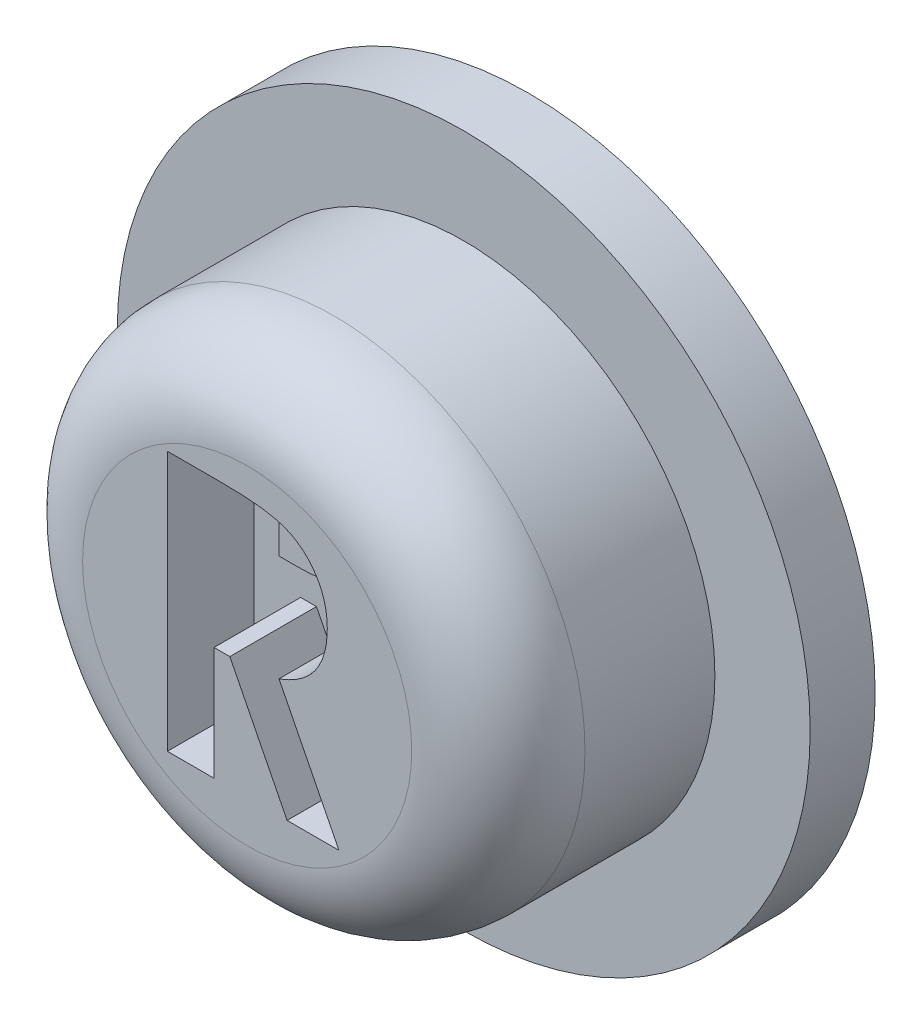
from build123d import *

# Parameters (mm, degrees)
SZKIC1_R                    = 4
DODANIE_WYCI_GNI_CIE1_DEPTH = 0.75
SZKIC2_R                    = 2.9
DODANIE_WYCI_GNI_CIE2_DEPTH = 2.5
SZKIC3_W                    = 2.5
SZKIC3_H                    = 2.5
WYTNIJ_WYCI_GNI_CIE1_DEPTH  = 1
ZAOKR_GLENIE2_R             = 1
SZKIC4_W                    = 2.9
SZKIC4_H                    = 2.9
WYTNIJ_WYCI_GNI_CIE2_DEPTH  = 1
WYTNIJ_WYCI_GNI_CIE3_DEPTH  = 1
WYTNIJ_WYCI_GNI_CIE4_DEPTH  = 0.75


with BuildPart() as part:
    # Szkic1 → Dodanie-wyciągnięcie1 (new body)
    with BuildSketch(Plane.XY):
        Circle(SZKIC1_R)
    extrude(amount=DODANIE_WYCI_GNI_CIE1_DEPTH)

    # Szkic2 → Dodanie-wyciągnięcie2 (add)
    with BuildSketch(Plane.XY.offset(0.75)):
        Circle(SZKIC2_R)
    extrude(amount=DODANIE_WYCI_GNI_CIE2_DEPTH)

    # Szkic3 → Wytnij-wyciągnięcie1 (cut)
    with BuildSketch(Plane(origin=(0, 0, 0), x_dir=(-1, 0, 0), z_dir=(0, 0, -1))):
        Rectangle(SZKIC3_W, SZKIC3_H)
    extrude(amount=-WYTNIJ_WYCI_GNI_CIE1_DEPTH, mode=Mode.SUBTRACT)

    # Zaokrąglenie2
    zaokr_glenie2_edges = [part.edges().sort_by_distance(p)[0] for p in [
        (-2.9, 0, 3.25),
    ]]
    fillet(zaokr_glenie2_edges, radius=ZAOKR_GLENIE2_R)

    # Szkic4 → Wytnij-wyciągnięcie2 (cut)
    with BuildSketch(Plane(origin=(0, 0, 0), x_dir=(-1, 0, 0), z_dir=(0, 0, -1))):
        Rectangle(SZKIC4_W, SZKIC4_H)
    extrude(amount=-WYTNIJ_WYCI_GNI_CIE2_DEPTH, mode=Mode.SUBTRACT)

    # Szkic5 → Wytnij-wyciągnięcie3 (cut)
    with BuildSketch(Plane.XY.offset(3.25)):
        with BuildLine():
            Line((-0.921182905, 1.584423241), (-0.293779059, 1.584423241))
            add(Edge.make_bspline(
                [(-0.293779059, 1.584423241), (-0.252307855, 1.584276042), (-0.17254705, 1.583992937), (-0.057536324, 1.579526289), (0.048116843, 1.573310581), (0.144568883, 1.563825246), (0.23177853, 1.551248838), (0.309833189, 1.536423335), (0.378730579, 1.519526495), (0.439051754, 1.4984717), (0.493488632, 1.47472221), (0.54423137, 1.44743361), (0.592399429, 1.416909768), (0.637670857, 1.382347519), (0.680439074, 1.344368629), (0.720784764, 1.302934869), (0.758137806, 1.257694897), (0.792266907, 1.208934573), (0.823372836, 1.15763983), (0.850863953, 1.10374024), (0.873219776, 1.04719832), (0.892973541, 0.988831223), (0.907201538, 0.927804579), (0.917096902, 0.864712494), (0.924341901, 0.799332876), (0.924758453, 0.754916866), (0.924970941, 0.73225978)],
                knots=[0, 0, 0, 0, 1.749336639, 3.364467119, 4.854658419, 6.213483162, 7.451590619, 8.570285859, 9.5643256, 10.440900261, 11.26203566, 12.067320669, 12.869050712, 13.665104639, 14.467235401, 15.27997916, 16.102287765, 16.939272006, 17.78853747, 18.631303466, 19.488103222, 20.351255419, 21.228522269, 22.127379805, 23.044756219, 24, 24, 24, 24], degree=3))
            add(Edge.make_bspline(
                [(0.924970941, 0.73225978), (0.924418974, 0.708610987), (0.923336666, 0.662240014), (0.917506767, 0.594124836), (0.906851544, 0.528956999), (0.890712658, 0.466927305), (0.872163104, 0.407263723), (0.847496956, 0.351067083), (0.819658771, 0.297520087), (0.786596171, 0.247380176), (0.750311583, 0.199533643), (0.70811337, 0.155813667), (0.662735328, 0.113870465), (0.611626594, 0.076331215), (0.557040086, 0.040657651), (0.497891228, 0.008327901), (0.434566047, -0.021470729), (0.390045308, -0.038088504), (0.367278634, -0.046586374)],
                knots=[0, 0, 0, 0, 1.099860209, 2.156625411, 3.176576793, 4.16617041, 5.135385252, 6.078461593, 7.016046972, 7.938469504, 8.868247731, 9.803980173, 10.76021508, 11.73834243, 12.748633912, 13.790971185, 14.870363756, 16, 16, 16, 16], degree=3))
            Line((0.367278634, -0.046586374), (1.059586326, -1.415576759))
            Line((1.059586326, -1.415576759), (0.461028634, -1.415576759))
            Line((0.461028634, -1.415576759), (-0.200029059, -0.107884451))
            Line((-0.200029059, -0.107884451), (-0.382721366, -0.107884451))
            Line((-0.382721366, -0.107884451), (-0.382721366, -1.415576759))
            Line((-0.382721366, -1.415576759), (-0.921182905, -1.415576759))
            Line((-0.921182905, -1.415576759), (-0.921182905, 1.584423241))
        make_face()
        with BuildLine():
            Line((-0.382721366, 0.430577087), (-0.172985789, 0.430577087))
            add(Edge.make_bspline(
                [(-0.172985789, 0.430577087), (-0.147343872, 0.430865884), (-0.098245109, 0.431418867), (-0.02763464, 0.433983833), (0.036496506, 0.440164132), (0.09442373, 0.44797271), (0.146438515, 0.456988841), (0.192076908, 0.469909503), (0.232042127, 0.48375432), (0.265860584, 0.500959836), (0.294754296, 0.520526239), (0.319702167, 0.54275416), (0.340337634, 0.568480148), (0.357321675, 0.597005082), (0.370533413, 0.628581257), (0.38017697, 0.66286204), (0.385566291, 0.700237931), (0.386186351, 0.726032386), (0.386509403, 0.739471318)],
                knots=[0, 0, 0, 0, 1.688639943, 3.233382647, 4.650958383, 5.928841754, 7.082724185, 8.122798841, 9.049171256, 9.863274652, 10.613301712, 11.341792392, 12.054588806, 12.776240173, 13.521029143, 14.301969904, 15.115324896, 16, 16, 16, 16], degree=3))
            add(Edge.make_bspline(
                [(0.386509403, 0.739471318), (0.385898644, 0.755370556), (0.384698922, 0.786601663), (0.372793947, 0.831563506), (0.353843798, 0.873178768), (0.327868335, 0.911259421), (0.295155616, 0.94464355), (0.257615189, 0.974071926), (0.214436843, 0.997341683), (0.174456944, 1.012690168), (0.138084581, 1.021873324), (0.10525967, 1.028716531), (0.067248226, 1.033566508), (0.024021552, 1.038710772), (-0.024310165, 1.042046567), (-0.078010364, 1.044481033), (-0.136924816, 1.045477092), (-0.177993785, 1.045795515), (-0.199428097, 1.045961703)],
                knots=[0, 0, 0, 0, 1.020303359, 2.004196876, 2.966617323, 3.9489082, 4.950758222, 5.960522915, 7.003732012, 8.091992268, 8.70421221, 9.413913587, 10.24622431, 11.166358409, 12.212345909, 13.359657661, 14.621978493, 16, 16, 16, 16], degree=3))
            Line((-0.199428097, 1.045961703), (-0.382721366, 1.045961703))
            Line((-0.382721366, 1.045961703), (-0.382721366, 0.430577087))
        make_face(mode=Mode.SUBTRACT)
    extrude(amount=-WYTNIJ_WYCI_GNI_CIE3_DEPTH, mode=Mode.SUBTRACT)

    # Szkic6 → Wytnij-wyciągnięcie4 (cut)
    with BuildSketch(Plane.XY.offset(3.25)):
        with BuildLine():
            Line((-0.199428097, 1.045961703), (-0.382721366, 1.045961703))
            Line((-0.382721366, 1.045961703), (-0.382721366, 0.430577087))
            Line((-0.382721366, 0.430577087), (-0.172985789, 0.430577087))
            add(Edge.make_bspline(
                [(-0.172985789, 0.430577087), (-0.147343872, 0.430865884), (-0.098245109, 0.431418867), (-0.02763464, 0.433983833), (0.036496506, 0.440164132), (0.09442373, 0.44797271), (0.146438515, 0.456988841), (0.192076908, 0.469909503), (0.232042127, 0.48375432), (0.265860584, 0.500959836), (0.294754296, 0.520526239), (0.319702167, 0.54275416), (0.340337634, 0.568480148), (0.357321675, 0.597005082), (0.370533413, 0.628581257), (0.38017697, 0.66286204), (0.385566291, 0.700237931), (0.386186351, 0.726032386), (0.386509403, 0.739471318)],
                knots=[0, 0, 0, 0, 0.105539996, 0.202086415, 0.290684899, 0.37055261, 0.442670262, 0.507674928, 0.565573203, 0.616454666, 0.663331357, 0.708862024, 0.7534118, 0.798515011, 0.845064321, 0.893873119, 0.944707806, 1, 1, 1, 1], degree=3))
            add(Edge.make_bspline(
                [(0.386509403, 0.739471318), (0.385898644, 0.755370556), (0.384698922, 0.786601663), (0.372793947, 0.831563506), (0.353843798, 0.873178768), (0.327868335, 0.911259421), (0.295155616, 0.94464355), (0.257615189, 0.974071926), (0.214436843, 0.997341683), (0.174456944, 1.012690168), (0.138084581, 1.021873324), (0.10525967, 1.028716531), (0.067248226, 1.033566508), (0.024021552, 1.038710772), (-0.024310165, 1.042046567), (-0.078010364, 1.044481033), (-0.136924816, 1.045477092), (-0.177993785, 1.045795515), (-0.199428097, 1.045961703)],
                knots=[0, 0, 0, 0, 0.06376896, 0.125262305, 0.185413583, 0.246806762, 0.309422389, 0.372532682, 0.437733251, 0.505749517, 0.544013263, 0.588369599, 0.640389019, 0.697897401, 0.763271619, 0.834978604, 0.913873656, 1, 1, 1, 1], degree=3))
        make_face()
    extrude(amount=-WYTNIJ_WYCI_GNI_CIE4_DEPTH, mode=Mode.SUBTRACT)


solid = part.part
